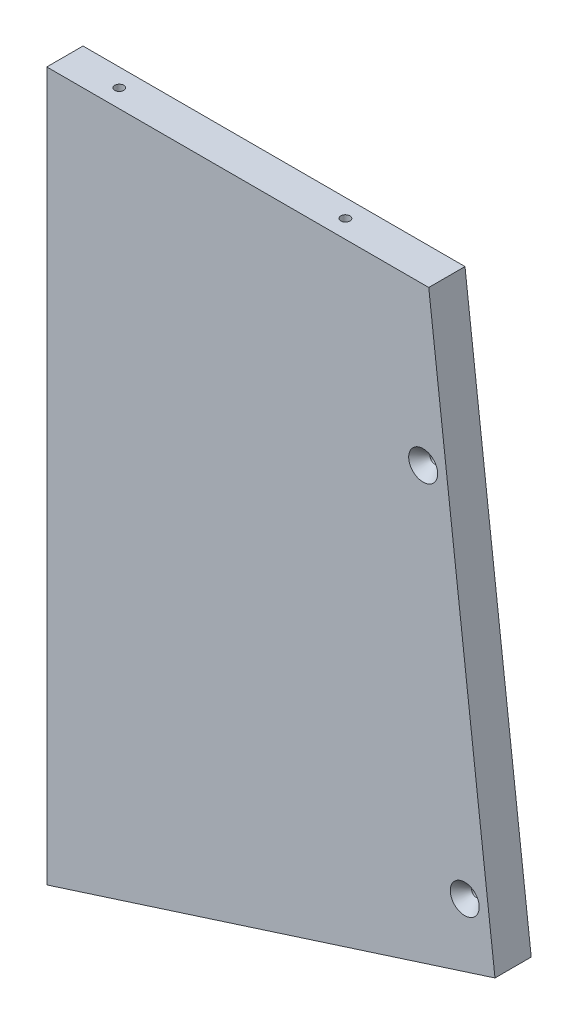
from build123d import *

# Parameters (mm, degrees)
BOSS_EXTRUDE1_DEPTH = 12.7
HOLE3_D             = 3.175
HOLE3_DEPTH         = 31.75
HOLE3_CSINK_D       = 10.16
HOLE3_CSINK_ANGLE   = 82
HOLE3_TIP           = 0.953866233
HOLE6_D             = 3.175
HOLE6_DEPTH         = 38.1
HOLE6_CSINK_D       = 10.16
HOLE6_CSINK_ANGLE   = 82
HOLE6_TIP           = 0.953866233
HOLE7_D             = 3.175
HOLE7_DEPTH         = 31.75
HOLE7_CSINK_D       = 10.16
HOLE7_CSINK_ANGLE   = 82
HOLE7_TIP           = 0.953866233
HOLE8_D             = 3.175
HOLE8_DEPTH         = 31.75
HOLE8_CSINK_D       = 10.16
HOLE8_CSINK_ANGLE   = 82
HOLE8_TIP           = 0.953866233


with BuildPart() as part:
    # Sketch1 → Boss-Extrude1 (new body)
    with BuildSketch(Plane.XY):
        Polygon((-88.190159952, 0), (-222.052967181, 0), (-222.052967181, -248.25), (-64.977416983, -197.966048293), align=None)
    extrude(amount=-BOSS_EXTRUDE1_DEPTH)

    # Hole3
    with Locations(Plane(origin=(-234.752967181, 1073.364195846, -135.816741379), x_dir=(0, 0, -1), z_dir=(-1, 0, 0))):
        with Locations((-129.466741379, 1300.662770337), (-129.466741379, 1128.612770337), (129.198788767, 1128.612770337), (129.198788767, 1300.662770337)):
            CounterSinkHole(HOLE3_D / 2, HOLE3_CSINK_D / 2, depth=HOLE3_DEPTH, counter_sink_angle=HOLE3_CSINK_ANGLE)
            with Locations((0, 0, -(HOLE3_DEPTH + HOLE3_TIP / 2))):  # 118° drill point
                Cone(0, HOLE3_D / 2, HOLE3_TIP, mode=Mode.SUBTRACT)

    # Hole6
    with Locations(Plane(origin=(181.039434513, 1073.364195846, 0), x_dir=(-0.9271838545667885, -0.3746065934159093, 0), z_dir=(0, 0, 1))):
        with Locations((707.166557203, 1065.270372796), (674.127983646, 944.603090451)):
            CounterSinkHole(HOLE6_D / 2, HOLE6_CSINK_D / 2, depth=HOLE6_DEPTH, counter_sink_angle=HOLE6_CSINK_ANGLE)
            with Locations((0, 0, -(HOLE6_DEPTH + HOLE6_TIP / 2))):  # 118° drill point
                Cone(0, HOLE6_D / 2, HOLE6_TIP, mode=Mode.SUBTRACT)

    # Hole7
    with Locations(Plane(origin=(181.039434513, 12.7, -135.816741379), x_dir=(0, 0, -1), z_dir=(0, 1, 0))):
        with Locations((129.198788767, 384.042401694), (-129.466741379, 384.042401694), (-129.466741379, 304.786761906), (-110.416741379, 409.442401694), (-0.133976306, 409.442401694), (110.148788767, 409.442401694), (129.198788767, 304.786761906)):
            CounterSinkHole(HOLE7_D / 2, HOLE7_CSINK_D / 2, depth=HOLE7_DEPTH, counter_sink_angle=HOLE7_CSINK_ANGLE)
            with Locations((0, 0, -(HOLE7_DEPTH + HOLE7_TIP / 2))):  # 118° drill point
                Cone(0, HOLE7_D / 2, HOLE7_TIP, mode=Mode.SUBTRACT)

    # Hole8
    with Locations(Plane(origin=(531.197640696, -20.449854654, -135.816741379), x_dir=(0, 0, 1), z_dir=(0.3048844921716131, -0.9523893355310409, 0))):
        with Locations((-129.257383629, 761.035393152), (129.466741379, 663.01461615), (129.466741379, 760.835922116), (-129.408220012, 663.214203478)):
            CounterSinkHole(HOLE8_D / 2, HOLE8_CSINK_D / 2, depth=HOLE8_DEPTH, counter_sink_angle=HOLE8_CSINK_ANGLE)
            with Locations((0, 0, -(HOLE8_DEPTH + HOLE8_TIP / 2))):  # 118° drill point
                Cone(0, HOLE8_D / 2, HOLE8_TIP, mode=Mode.SUBTRACT)


solid = part.part
